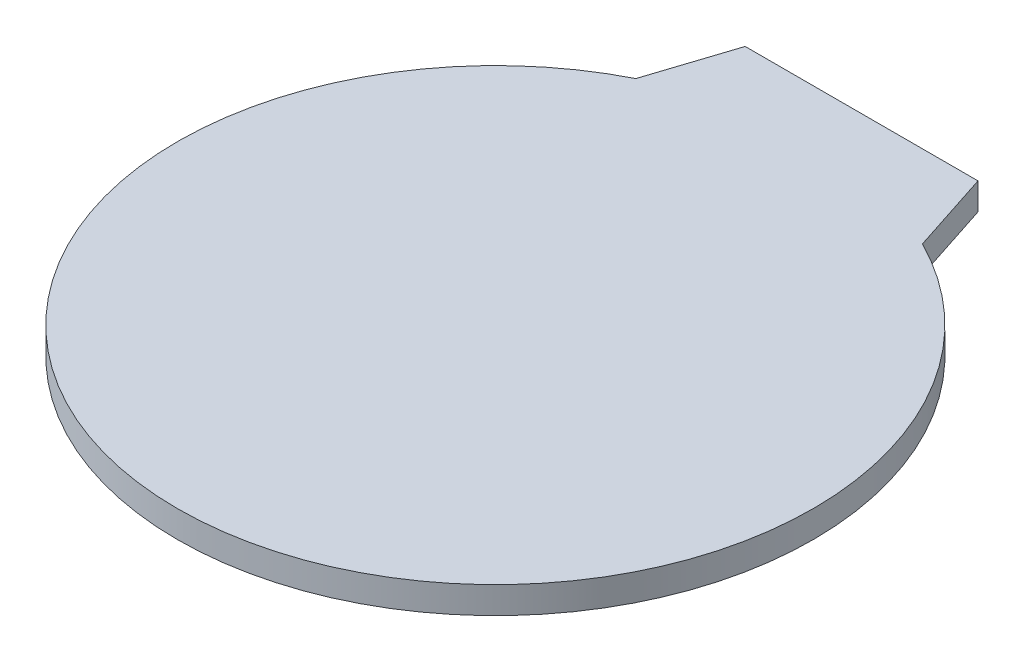
from build123d import *

# Parameters (mm, degrees)
SKETCH1_R           = 17.75
BOSS_EXTRUDE2_DEPTH = 1.5


with BuildPart() as part:
    # Sketch1 → Boss-Extrude2 (new body)
    with BuildSketch(Plane(origin=(0, 0, 0), x_dir=(1, 0, 0), z_dir=(0, 1, 0))):
        with BuildLine():
            Line((6.5, 20.45), (-6.5, 20.45))
            Line((-6.5, 20.45), (-8, 15.844951877))
            ThreePointArc((-8, 15.844951877), (0, 17.75), (8, 15.844951877))
            Line((8, 15.844951877), (6.5, 20.45))
        make_face()
        Circle(SKETCH1_R)
    extrude(amount=BOSS_EXTRUDE2_DEPTH)


solid = part.part
